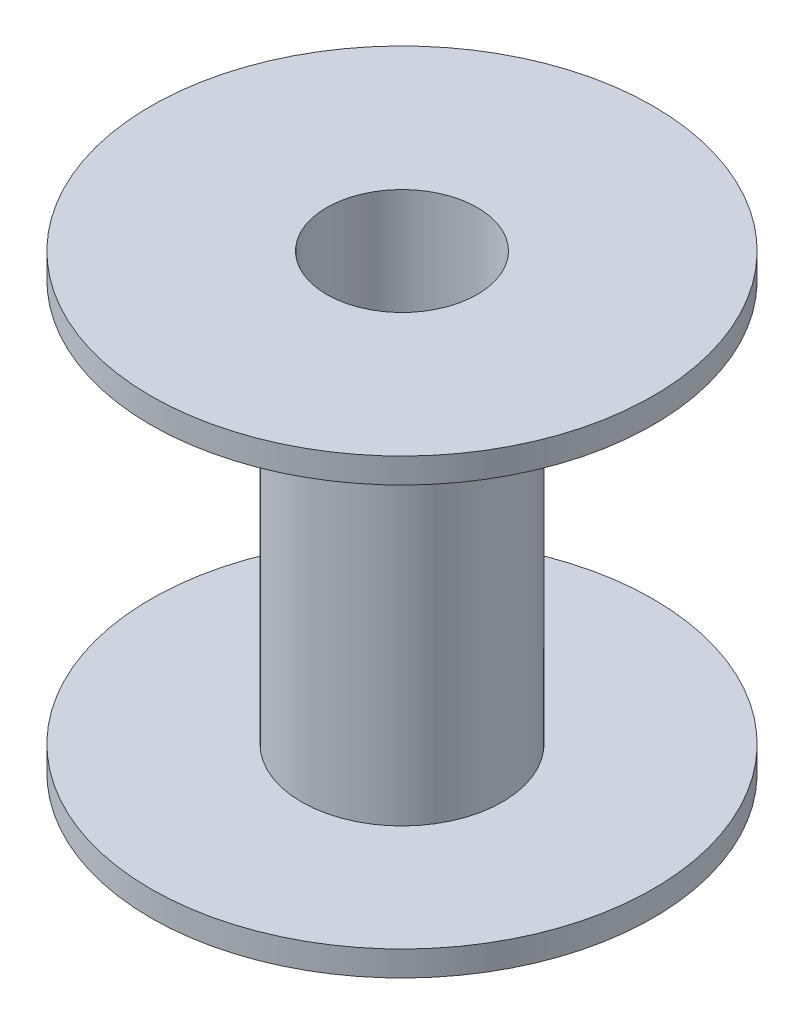
from build123d import *


with BuildPart() as part:
    # Sketch1 → Revolve1 (revolve)
    with BuildSketch(Plane(origin=(0, 0, 0), x_dir=(0, 0, -1), z_dir=(1, 0, 0))):
        Polygon((-7.5, 1.597752968), (-25, 1.597752968), (-25, -0.902247032), (-10, -0.902247032), (-10, -40.902247032), (-25, -40.902247032), (-25, -43.402247032), (-7.5, -43.402247032), align=None)
    revolve(axis=Axis((0, 20.028113297, 0), (0, -1, 0)))


solid = part.part
